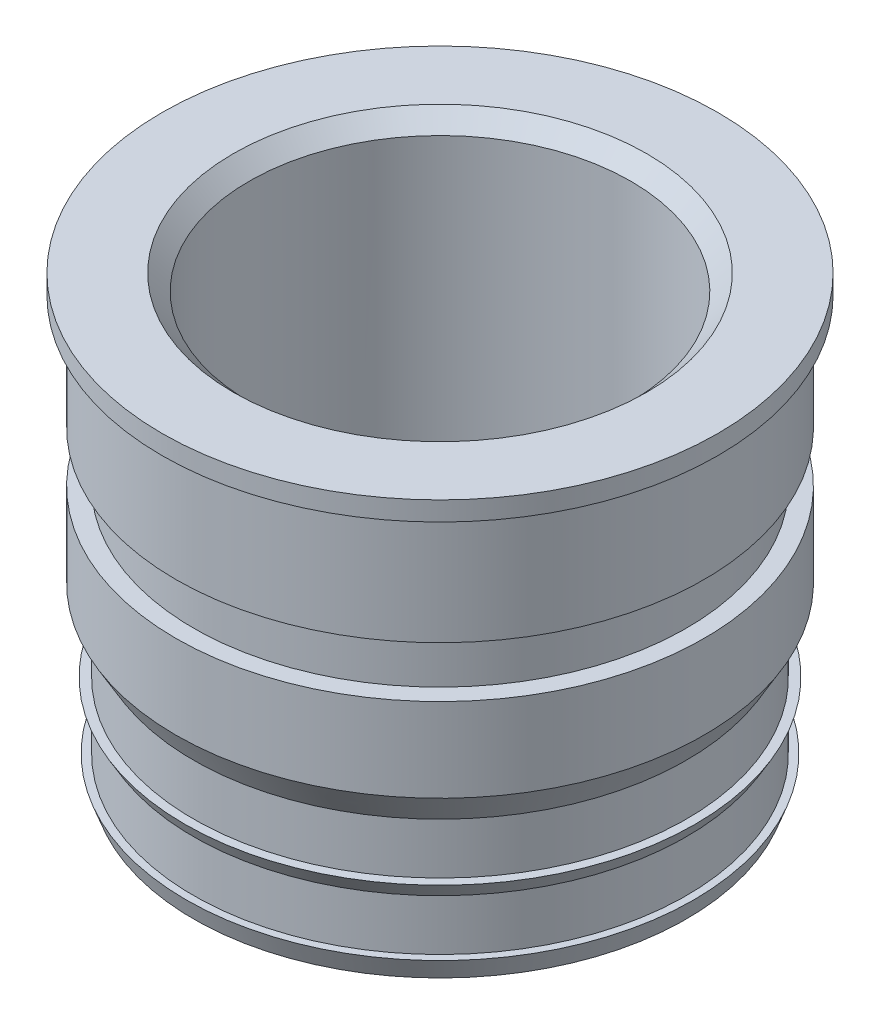
from build123d import *

# Parameters (mm, degrees)
CHAMFER1_SIZE = 0.125


with BuildPart() as part:
    # Sketch2 → Revolve1 (revolve)
    with BuildSketch(Plane(origin=(0, 0, 0), x_dir=(0, 0, -1), z_dir=(1, 0, 0))):
        Polygon((-1.5, 1.715), (-1.5, -1.715), (-1.936893204, -1.715), (-1.995, -1.55535289), (-1.936893204, -1.55535289), (-1.936893204, -1.154868773), (-2.006321602, -1.03461526), (-1.936893204, -1.03461526), (-1.936893204, -0.634131143), (-2.07575, -0.393624117), (-2.07575, 0.264935883), (-1.936893204, 0.264935883), (-1.936893204, 0.66542), (-2.07575, 0.66542), (-2.07575, 1.48862), (-1.8425, 1.48862), (-1.8425, 1.56408), (-2.185, 1.56408), (-2.185, 1.715), align=None)
    revolve(axis=Axis((0, -1.715, 0), (0, 1, 0)))

    # Chamfer1
    chamfer1_edges = [part.edges().sort_by_distance(p)[0] for p in [
        (0, -1.715, -1.5),
        (0, 1.715, -1.5),
    ]]
    chamfer(chamfer1_edges, length=CHAMFER1_SIZE)


solid = part.part
